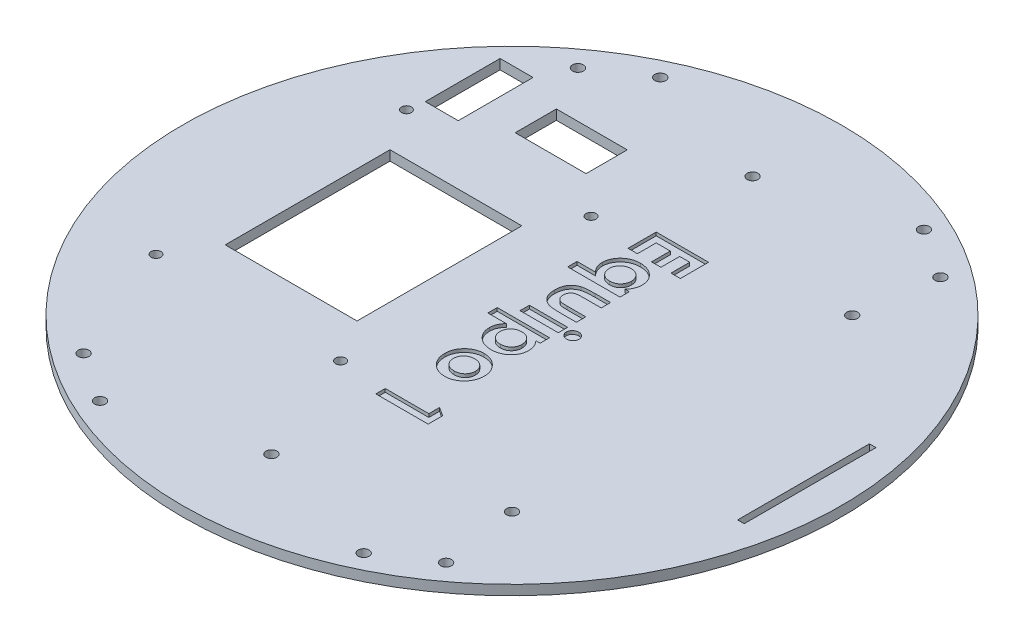
from build123d import *

# Parameters (mm, degrees)
CROQUIS1_R              = 100
CROQUIS1_R_2            = 1.65
CROQUIS1_R_3            = 1.5
CROQUIS1_W              = 10
CROQUIS1_H              = 22.7
CROQUIS1_W_2            = 21.5
CROQUIS1_H_2            = 12.5
CROQUIS1_W_3            = 40
CROQUIS1_H_3            = 50
CROQUIS1_W_4            = 2
CROQUIS1_H_4            = 40
SALIENTE_EXTRUIR1_DEPTH = 3
CROQUIS2_W              = 11.600961538
CROQUIS2_H              = 2.849358975
CORTAR_EXTRUIR1_DEPTH   = 1


with BuildPart() as part:
    # Croquis1 → Saliente-Extruir1 (new body)
    with BuildSketch(Plane(origin=(0, 0, 0), x_dir=(1, 0, 0), z_dir=(0, 1, 0))):
        with Locations(Location((0, 0, 0), (0, 0, 270))):
            Circle(CROQUIS1_R)
        with Locations(Location((55, 75, 0), (0, 0, 270))):
            Circle(CROQUIS1_R_2, mode=Mode.SUBTRACT)
        with Locations(Location((55, -75, 0), (0, 0, 90))):
            Circle(CROQUIS1_R_2, mode=Mode.SUBTRACT)
        with Locations(Location((0, -73, 0), (0, 0, 270))):
            Circle(CROQUIS1_R_2, mode=Mode.SUBTRACT)
        with Locations(Location((51.618795027, -51.618795027, 0), (0, 0, 270))):
            Circle(CROQUIS1_R_2, mode=Mode.SUBTRACT)
        with Locations(Location((51.618795027, 51.618795027, 0), (0, 0, 270))):
            Circle(CROQUIS1_R_2, mode=Mode.SUBTRACT)
        with Locations(Location((0, 73, 0), (0, 0, 270))):
            Circle(CROQUIS1_R_2, mode=Mode.SUBTRACT)
        with Locations(Location((40, -85, 0), (0, 0, 270))):
            Circle(CROQUIS1_R_2, mode=Mode.SUBTRACT)
        with Locations(Location((40, 85, 0), (0, 0, 90))):
            Circle(CROQUIS1_R_2, mode=Mode.SUBTRACT)
        with Locations(Location((-70.020295338, 38, 0), (0, 0, 270))):
            Circle(CROQUIS1_R_3, mode=Mode.SUBTRACT)
        with Locations(Location((-14.020295338, 38, 0), (0, 0, 270))):
            Circle(CROQUIS1_R_3, mode=Mode.SUBTRACT)
        with Locations(Location((-14.020295338, -38, 0), (0, 0, 90))):
            Circle(CROQUIS1_R_3, mode=Mode.SUBTRACT)
        with Locations(Location((-70.020295338, -38, 0), (0, 0, 90))):
            Circle(CROQUIS1_R_3, mode=Mode.SUBTRACT)
        with Locations(Location((-40, -85, 0), (0, 0, 90))):
            Circle(CROQUIS1_R_2, mode=Mode.SUBTRACT)
        with Locations(Location((-55, -75, 0), (0, 0, 270))):
            Circle(CROQUIS1_R_2, mode=Mode.SUBTRACT)
        with Locations(Location((-55, 75, 0), (0, 0, 90))):
            Circle(CROQUIS1_R_2, mode=Mode.SUBTRACT)
        with Locations(Location((-40, 85, 0), (0, 0, 270))):
            Circle(CROQUIS1_R_2, mode=Mode.SUBTRACT)
        with Locations((-64.299296542, 54.335107278)):
            Rectangle(CROQUIS1_W, CROQUIS1_H, mode=Mode.SUBTRACT)
        with Locations((-36.742208882, 54.713188989)):
            Rectangle(CROQUIS1_W_2, CROQUIS1_H_2, mode=Mode.SUBTRACT)
        with Locations((-42.020295338, 0)):
            Rectangle(CROQUIS1_W_3, CROQUIS1_H_3, mode=Mode.SUBTRACT)
        with Locations((89, 0.459343657)):
            Rectangle(CROQUIS1_W_4, CROQUIS1_H_4, mode=Mode.SUBTRACT)
    extrude(amount=SALIENTE_EXTRUIR1_DEPTH)

    # Croquis2 → Cortar-Extruir1 (cut)
    # profile 1 of 8: a face of its own
    with BuildSketch(Plane(origin=(0, 3, 0), x_dir=(1, 0, 0), z_dir=(0, 1, 0))):
        Polygon((15.875, 43.758012821), (15.875, 35.209935897), (13.025641026, 35.209935897), (13.025641026, 40.908653846), (9.97275641, 40.908653846), (9.97275641, 35.209935897), (7.123397436, 35.209935897), (7.123397436, 40.908653846), (2.849358974, 40.908653846), (2.849358974, 35.209935897), (0, 35.209935897), (0, 43.758012821), align=None)
    # profile 2 of 8: a face of its own
    with BuildSketch(Plane(origin=(0, 3, 0), x_dir=(1, 0, 0), z_dir=(0, 1, 0))):
        with BuildLine():
            Line((11.600961538, 24.016025641), (11.600961538, 21.166666667))
            Line((11.600961538, 21.166666667), (-4.274038462, 21.166666667))
            Line((-4.274038462, 21.166666667), (-4.274038462, 24.016025641))
            Line((-4.274038462, 24.016025641), (1.310196314, 24.016025641))
            add(Edge.make_bspline(
                [(1.310196314, 24.016025641), (1.182705355, 24.157092769), (0.935757113, 24.430337862), (0.615378556, 24.861936061), (0.354378825, 25.295294207), (0.142091591, 25.73048468), (-0.014973458, 26.176723268), (-0.121521471, 26.638806522), (-0.19151115, 27.11765791), (-0.199480276, 27.443909989), (-0.203525641, 27.60952524)],
                knots=[0, 0, 0, 0, 1.139408452, 2.207018561, 3.216197651, 4.168344369, 5.104925937, 6.045165285, 7.007667804, 8, 8, 8, 8], degree=3))
            add(Edge.make_bspline(
                [(-0.203525641, 27.60952524), (-0.199344469, 27.795369564), (-0.191082236, 28.16260848), (-0.104117769, 28.70149432), (0.02901976, 29.221828549), (0.217356605, 29.723253731), (0.461659933, 30.204613147), (0.753956, 30.669820187), (1.109289804, 31.108133844), (1.505302715, 31.529047649), (1.943960603, 31.913441124), (2.412740169, 32.254206023), (2.911920377, 32.537382786), (3.435041679, 32.770158264), (3.983367559, 32.952997213), (4.558338939, 33.083403241), (5.160242355, 33.160326524), (5.57023229, 33.169848825), (5.778220152, 33.174679487)],
                knots=[0, 0, 0, 0, 0.980545136, 1.937612761, 2.874348888, 3.813122963, 4.759326438, 5.720509799, 6.70829705, 7.733758992, 8.768951258, 9.783355028, 10.788637727, 11.793421666, 12.80232853, 13.835642703, 14.90202171, 16, 16, 16, 16], degree=3))
            add(Edge.make_bspline(
                [(5.778220152, 33.174679487), (5.993593054, 33.169611753), (6.416070998, 33.159670827), (7.036021596, 33.086905677), (7.625310633, 32.959010712), (8.18447819, 32.784192263), (8.715089265, 32.560628848), (9.213817184, 32.282772034), (9.685139619, 31.957538275), (10.117309543, 31.581719657), (10.511841102, 31.176010106), (10.860146838, 30.744592416), (11.14877756, 30.287352273), (11.390953126, 29.811545214), (11.574543534, 29.3124596), (11.709863619, 28.793096557), (11.790858096, 28.25128417), (11.799906423, 27.882225345), (11.804487179, 27.69538762)],
                knots=[0, 0, 0, 0, 1.136421085, 2.229216585, 3.287981067, 4.314102594, 5.316702899, 6.320753391, 7.321604446, 8.333029371, 9.337827526, 10.304906535, 11.253050047, 12.186157492, 13.117149921, 14.053303955, 15.014476191, 16, 16, 16, 16], degree=3))
            add(Edge.make_bspline(
                [(11.804487179, 27.69538762), (11.800891521, 27.522313136), (11.793777009, 27.179861115), (11.716527019, 26.676505986), (11.599691896, 26.18832411), (11.433222876, 25.717978542), (11.223021872, 25.261611354), (10.959624346, 24.827072347), (10.654100778, 24.40485559), (10.4154804, 24.147236982), (10.293945313, 24.016025641)],
                knots=[0, 0, 0, 0, 1.017011718, 2.012299608, 2.98747302, 3.965332399, 4.941441765, 5.936729654, 6.94912688, 8, 8, 8, 8], degree=3))
            Line((10.293945313, 24.016025641), (11.600961538, 24.016025641))
        make_face()
        with BuildLine():
            add(Edge.make_bspline(
                [(9.158653846, 27.09753105), (9.155170091, 27.211069605), (9.148342159, 27.433597761), (9.107271672, 27.760855868), (9.034903644, 28.073616444), (8.927995423, 28.369648907), (8.797765633, 28.653365226), (8.634654964, 28.920457128), (8.44186162, 29.173128999), (8.224053125, 29.409894852), (7.984641765, 29.625741812), (7.7233921, 29.811814489), (7.447343323, 29.969946203), (7.155665451, 30.103684536), (6.844907033, 30.199410839), (6.519113591, 30.275226032), (6.175623559, 30.314569209), (5.941545733, 30.321700886), (5.822741386, 30.325320513)],
                knots=[0, 0, 0, 0, 1.04836806, 2.054732945, 3.03993516, 4.00574415, 4.955904794, 5.917688631, 6.888591924, 7.88601754, 8.884115178, 9.859153345, 10.841239365, 11.818093293, 12.814750328, 13.83810466, 14.90274714, 16, 16, 16, 16], degree=3))
            add(Edge.make_bspline(
                [(5.822741386, 30.325320513), (5.702858497, 30.321757782), (5.466630654, 30.314737461), (5.120256254, 30.274571775), (4.789656447, 30.201567368), (4.477782074, 30.094637482), (4.178924754, 29.96529649), (3.89874528, 29.80239368), (3.636314535, 29.608468623), (3.389290271, 29.392304657), (3.170241279, 29.150708555), (2.970940116, 28.899037757), (2.811425852, 28.627418798), (2.67510816, 28.345228985), (2.570409389, 28.049899345), (2.496955214, 27.739632089), (2.452004353, 27.41685702), (2.445562232, 27.19625709), (2.442307692, 27.084810697)],
                knots=[0, 0, 0, 0, 1.099386164, 2.166327687, 3.192099357, 4.19717067, 5.185034887, 6.173616074, 7.161193358, 8.17338296, 9.177655011, 10.147763629, 11.111227589, 12.058972978, 13.018112925, 13.97759754, 14.978288615, 16, 16, 16, 16], degree=3))
            add(Edge.make_bspline(
                [(2.442307692, 27.084810697), (2.445811079, 26.969157453), (2.452679622, 26.742414224), (2.493373865, 26.409815653), (2.56601244, 26.092858719), (2.673513826, 25.792831788), (2.802878561, 25.505263884), (2.962541517, 25.232337048), (3.156358201, 24.977948758), (3.372463452, 24.736092064), (3.618697596, 24.52247288), (3.878710723, 24.328470569), (4.161618889, 24.169460791), (4.461219477, 24.039009801), (4.77862315, 23.93677771), (5.113871089, 23.863036473), (5.467723387, 23.823015946), (5.709225797, 23.816049635), (5.832281651, 23.8125)],
                knots=[0, 0, 0, 0, 1.049905731, 2.058385982, 3.036337956, 3.994927362, 4.946537361, 5.895419282, 6.857623746, 7.845325573, 8.833777008, 9.811444928, 10.78531754, 11.772081556, 12.77319045, 13.807459548, 14.882806445, 16, 16, 16, 16], degree=3))
            add(Edge.make_bspline(
                [(5.832281651, 23.8125), (5.953220966, 23.816005526), (6.18945058, 23.822852836), (6.535915008, 23.863209778), (6.864578235, 23.937472302), (7.17644787, 24.037595466), (7.468869386, 24.17030519), (7.745012077, 24.3295017), (8.001354596, 24.521398943), (8.241310317, 24.737363961), (8.454387149, 24.977834782), (8.645675208, 25.233743387), (8.80307129, 25.508010228), (8.936384619, 25.79545713), (9.032883331, 26.100698398), (9.107866972, 26.418156725), (9.148313434, 26.753053276), (9.155150794, 26.980831296), (9.158653846, 27.09753105)],
                knots=[0, 0, 0, 0, 1.106469885, 2.16125711, 3.184599668, 4.184238692, 5.152050012, 6.116650044, 7.094080022, 8.075733422, 9.064591803, 10.028460505, 10.993060537, 11.952039452, 12.921015874, 13.915988178, 14.932277727, 16, 16, 16, 16], degree=3))
        make_face(mode=Mode.SUBTRACT)
    # profile 3 of 8: a face of its own
    with BuildSketch(Plane(origin=(0, 3, 0), x_dir=(1, 0, 0), z_dir=(0, 1, 0))):
        with BuildLine():
            Line((11.600961538, 18.317307692), (11.600961538, 15.467948718))
            Line((11.600961538, 15.467948718), (6.032627204, 15.467948718))
            add(Edge.make_bspline(
                [(6.032627204, 15.467948718), (5.902230254, 15.467695694), (5.651966663, 15.467210078), (5.292539159, 15.453696968), (4.963859142, 15.434735422), (4.665539135, 15.411072635), (4.398296391, 15.375754615), (4.162642046, 15.334980852), (3.9568752, 15.288758392), (3.727529325, 15.213587273), (3.476502411, 15.096024264), (3.210228984, 14.918292937), (2.978576056, 14.703106139), (2.784234855, 14.450658865), (2.62913484, 14.164384176), (2.523090713, 13.845637122), (2.453265839, 13.497186133), (2.446056675, 13.253913145), (2.442307692, 13.127403846)],
                knots=[0, 0, 0, 0, 1.267467482, 2.432579623, 3.495718977, 4.46782216, 5.340771086, 6.114964255, 6.792308577, 7.388622481, 8.458084915, 9.475498183, 10.488937983, 11.51740562, 12.559360757, 13.637967653, 14.771671862, 16, 16, 16, 16], degree=3))
            add(Edge.make_bspline(
                [(2.442307692, 13.127403846), (2.446546729, 13.000997011), (2.45472659, 12.757075965), (2.518515318, 12.405444818), (2.62781943, 12.084571363), (2.776077557, 11.791160022), (2.974495808, 11.533863516), (3.21092523, 11.30984597), (3.489179721, 11.121228453), (3.696749598, 11.030589038), (3.803385417, 10.984024439)],
                knots=[0, 0, 0, 0, 1.116871431, 2.155171802, 3.144773418, 4.104381479, 5.046960687, 6.001340237, 6.973219418, 8, 8, 8, 8], degree=3))
            add(Edge.make_bspline(
                [(3.803385417, 10.984024439), (3.850752537, 10.966922485), (3.955309995, 10.929171895), (4.135721565, 10.895893992), (4.348192563, 10.858348722), (4.598252471, 10.836443202), (4.882179806, 10.813019652), (5.202496427, 10.797982309), (5.55767251, 10.788443406), (5.806833088, 10.787403291), (5.937224559, 10.786858974)],
                knots=[0, 0, 0, 0, 0.56097549, 1.238288705, 2.041265676, 2.968564175, 4.036154886, 5.220272437, 6.545304513, 8, 8, 8, 8], degree=3))
            Line((5.937224559, 10.786858974), (11.600961538, 10.786858974))
            Line((11.600961538, 10.786858974), (11.600961538, 7.9375))
            Line((11.600961538, 7.9375), (6.725886418, 7.9375))
            add(Edge.make_bspline(
                [(6.725886418, 7.9375), (6.484164326, 7.93794166), (6.020709914, 7.938788457), (5.355987143, 7.966574364), (4.75121546, 8.001763606), (4.206295595, 8.057111578), (3.71820111, 8.11986949), (3.29090059, 8.206561145), (2.920004648, 8.300525419), (2.700276104, 8.387023602), (2.598132011, 8.427233574)],
                knots=[0, 0, 0, 0, 1.388116509, 2.661439483, 3.820463473, 4.866642689, 5.806839029, 6.644994921, 7.370105668, 8, 8, 8, 8], degree=3))
            add(Edge.make_bspline(
                [(2.598132011, 8.427233574), (2.488186281, 8.478745772), (2.271162854, 8.580426427), (1.962684993, 8.756951183), (1.6701109, 8.946908519), (1.402374948, 9.160494194), (1.150066606, 9.388408436), (0.919150603, 9.635157407), (0.70921315, 9.901043325), (0.515122993, 10.181546008), (0.349485797, 10.484996834), (0.196361436, 10.803633063), (0.074471144, 11.145439876), (-0.027695055, 11.50556631), (-0.106871892, 11.886033682), (-0.164220551, 12.285307065), (-0.194929733, 12.705033257), (-0.20061339, 12.990614875), (-0.203525641, 13.136944111)],
                knots=[0, 0, 0, 0, 0.997222436, 1.96843142, 2.917797601, 3.860467999, 4.779133207, 5.709613475, 6.633219993, 7.560883278, 8.508369802, 9.470751391, 10.462672762, 11.485580885, 12.544670258, 13.653244457, 14.797545346, 16, 16, 16, 16], degree=3))
            add(Edge.make_bspline(
                [(-0.203525641, 13.136944111), (-0.201641841, 13.29501605), (-0.197955882, 13.604309234), (-0.152817334, 14.056182255), (-0.094413921, 14.486823318), (0.004882587, 14.891424344), (0.119922557, 15.275635774), (0.26674416, 15.635046644), (0.439364764, 15.971125596), (0.636760979, 16.284533912), (0.860741733, 16.572840909), (1.101625235, 16.842457418), (1.368995478, 17.084679058), (1.654595963, 17.30741338), (1.96105521, 17.508174545), (2.287283545, 17.687062196), (2.634764818, 17.844227862), (2.878299574, 17.928083541), (3.002003205, 17.970678085)],
                knots=[0, 0, 0, 0, 1.211240017, 2.369985978, 3.478996442, 4.539426614, 5.559871561, 6.551301256, 7.510778031, 8.453136967, 9.386094087, 10.30661716, 11.221130616, 12.147659962, 13.080758632, 14.026335491, 14.997475882, 16, 16, 16, 16], degree=3))
            add(Edge.make_bspline(
                [(3.002003205, 17.970678085), (3.09807618, 17.999737472), (3.305039765, 18.062338166), (3.648989087, 18.129927735), (4.045409938, 18.18398833), (4.494692255, 18.236576768), (4.99758926, 18.273263424), (5.553302285, 18.297242257), (6.162918027, 18.313444014), (6.587011348, 18.315981857), (6.80856871, 18.317307692)],
                knots=[0, 0, 0, 0, 0.627914866, 1.352675004, 2.190563461, 3.132055958, 4.183353232, 5.345633452, 6.613289997, 8, 8, 8, 8], degree=3))
            Line((6.80856871, 18.317307692), (11.600961538, 18.317307692))
        make_face()
    # profile 4 of 8: a face of its own
    with BuildSketch(Plane(origin=(0, 3, 0), x_dir=(1, 0, 0), z_dir=(0, 1, 0))):
        with BuildLine():
            add(Edge.make_bspline(
                [(16.485576923, 3.873347356), (16.479552428, 3.750538073), (16.467722753, 3.509390215), (16.352379597, 3.163946293), (16.171422459, 2.846765456), (15.92287827, 2.566888984), (15.627438307, 2.33246328), (15.292946062, 2.160163731), (14.927252059, 2.054825101), (14.67256665, 2.041870218), (14.542543069, 2.03525641)],
                knots=[0, 0, 0, 0, 0.990072662, 1.944103057, 2.911436544, 3.925658634, 4.950936715, 5.943676444, 6.950192893, 8, 8, 8, 8], degree=3))
            add(Edge.make_bspline(
                [(14.542543069, 2.03525641), (14.413632129, 2.042066341), (14.162443023, 2.055335816), (13.799333367, 2.157378418), (13.468904061, 2.329045718), (13.173268084, 2.560171451), (12.932265348, 2.840830028), (12.746647644, 3.150803338), (12.637968177, 3.493186577), (12.625115717, 3.730558581), (12.618589744, 3.851086739)],
                knots=[0, 0, 0, 0, 1.052811311, 2.051452972, 3.055194368, 4.079667233, 5.099438635, 6.06248364, 7.016205477, 8, 8, 8, 8], degree=3))
            add(Edge.make_bspline(
                [(12.618589744, 3.851086739), (12.62459448, 3.974964167), (12.636385017, 4.218202389), (12.7519724, 4.566535401), (12.9316034, 4.887729778), (13.184830409, 5.167238123), (13.484620915, 5.401735253), (13.821952255, 5.577914952), (14.194513536, 5.678320387), (14.451849984, 5.691801207), (14.583884215, 5.698717949)],
                knots=[0, 0, 0, 0, 0.988868435, 1.941682217, 2.906962409, 3.916910146, 4.938874109, 5.940910673, 6.943522087, 8, 8, 8, 8], degree=3))
            add(Edge.make_bspline(
                [(14.583884215, 5.698717949), (14.710637554, 5.691681985), (14.959626189, 5.677860849), (15.319102371, 5.577782626), (15.646986564, 5.404421838), (15.934660012, 5.169112791), (16.181706517, 4.89465114), (16.355904391, 4.577604723), (16.466711223, 4.234683839), (16.479223424, 3.995036507), (16.485576923, 3.873347356)],
                knots=[0, 0, 0, 0, 1.038763745, 2.040501419, 3.031928819, 4.058179968, 5.07455544, 6.03952971, 7.004503979, 8, 8, 8, 8], degree=3))
        make_face()
    # profile 5 of 8: a face of its own
    with BuildSketch(Plane(origin=(0, 3, 0), x_dir=(1, 0, 0), z_dir=(0, 1, 0))):
        with Locations((5.800480769, 3.86698718)):
            Rectangle(CROQUIS2_W, CROQUIS2_H)
    # profile 6 of 8: a face of its own
    with BuildSketch(Plane(origin=(0, 3, 0), x_dir=(1, 0, 0), z_dir=(0, 1, 0))):
        with BuildLine():
            Line((11.600961538, -3.052884615), (10.293945313, -3.052884615))
            add(Edge.make_bspline(
                [(10.293945313, -3.052884615), (10.415487473, -3.185166935), (10.654183735, -3.444955761), (10.959740403, -3.87031602), (11.222342865, -4.307377702), (11.432503856, -4.763540871), (11.600904646, -5.233306811), (11.715600021, -5.720986184), (11.794098352, -6.224076005), (11.800992287, -6.565514135), (11.804487179, -6.738606771)],
                knots=[0, 0, 0, 0, 1.054345398, 2.070625563, 3.070134531, 4.045138923, 5.016019057, 5.996139535, 6.984139557, 8, 8, 8, 8], degree=3))
            add(Edge.make_bspline(
                [(11.804487179, -6.738606771), (11.800011463, -6.925464626), (11.791195754, -7.293513968), (11.708888436, -7.835028534), (11.575844343, -8.353972516), (11.390078449, -8.852324553), (11.148892751, -9.32743034), (10.860117334, -9.784624761), (10.511840823, -10.216035475), (10.117343254, -10.621823462), (9.685005046, -10.997332369), (9.21473756, -11.323424328), (8.714133421, -11.596810101), (8.18461107, -11.821292147), (7.625273459, -11.995802291), (7.036031987, -12.12378349), (6.416068243, -12.196524807), (5.993592124, -12.206469041), (5.778220152, -12.211538462)],
                knots=[0, 0, 0, 0, 0.986020426, 1.942140297, 2.884184618, 3.810402461, 4.74398011, 5.692601402, 6.660167734, 7.665472218, 8.677406811, 9.678762208, 10.680617953, 11.68372348, 12.710362081, 13.769660087, 14.863006259, 16, 16, 16, 16], degree=3))
            add(Edge.make_bspline(
                [(5.778220152, -12.211538462), (5.570229461, -12.206714263), (5.160233948, -12.197204705), (4.558371021, -12.120188919), (3.983252451, -11.990119162), (3.435866735, -11.806198554), (2.911145705, -11.57815442), (2.412726298, -11.294134208), (1.944994707, -10.953371447), (1.504442115, -10.572260515), (1.108147286, -10.151128328), (0.756017565, -9.710521804), (0.460555089, -9.247488151), (0.217612644, -8.766335639), (0.028325999, -8.26418492), (-0.103230755, -7.743456083), (-0.191398892, -7.204832383), (-0.199443131, -6.838606626), (-0.203525641, -6.652744391)],
                knots=[0, 0, 0, 0, 1.098417511, 2.1652231, 3.198950626, 4.208261081, 5.211182938, 6.216867778, 7.231677337, 8.263598561, 9.289470716, 10.282037912, 11.238882362, 12.185464344, 13.124613954, 14.067146156, 15.019062619, 16, 16, 16, 16], degree=3))
            add(Edge.make_bspline(
                [(-0.203525641, -6.652744391), (-0.199508962, -6.487121695), (-0.191596347, -6.160854949), (-0.121045338, -5.681087293), (-0.015666111, -5.217626289), (0.142941374, -4.769858872), (0.353412172, -4.332751337), (0.615515497, -3.898859196), (0.935719324, -3.467179131), (1.182692488, -3.193945714), (1.310196314, -3.052884615)],
                knots=[0, 0, 0, 0, 0.990856396, 1.951927477, 2.896945079, 3.83213376, 4.788585491, 5.796263726, 6.862286081, 8, 8, 8, 8], degree=3))
            Line((1.310196314, -3.052884615), (-4.274038462, -3.052884615))
            Line((-4.274038462, -3.052884615), (-4.274038462, -0.203525641))
            Line((-4.274038462, -0.203525641), (11.600961538, -0.203525641))
            Line((11.600961538, -0.203525641), (11.600961538, -3.052884615))
        make_face()
        with BuildLine():
            add(Edge.make_bspline(
                [(9.158653846, -6.121669671), (9.155098078, -6.006034084), (9.14812684, -5.77932547), (9.108172098, -5.446477633), (9.033004956, -5.131091995), (8.935554764, -4.828403601), (8.804108651, -4.542134859), (8.644419788, -4.270356043), (8.455784846, -4.014481255), (8.238859456, -3.77779359), (8.003829778, -3.557333182), (7.742787362, -3.370720947), (7.470052884, -3.206288599), (7.176255453, -3.074758893), (6.864631798, -2.974246526), (6.535900111, -2.900092323), (6.189454567, -2.859705501), (5.953222316, -2.852862364), (5.832281651, -2.849358974)],
                knots=[0, 0, 0, 0, 1.060568847, 2.079291485, 3.067175794, 4.029236509, 4.990511307, 5.949030319, 6.915206611, 7.899210179, 8.889768581, 9.863784456, 10.835615511, 11.805743859, 12.80777611, 13.833568643, 14.890881125, 16, 16, 16, 16], degree=3))
            add(Edge.make_bspline(
                [(5.832281651, -2.849358974), (5.709224455, -2.852906441), (5.46771941, -2.859868496), (5.113886066, -2.899919636), (4.778570036, -2.973550902), (4.461409807, -3.076176174), (4.160437018, -3.205404323), (3.880917287, -3.369721817), (3.616241747, -3.558367732), (3.37487545, -3.776547601), (3.155097959, -4.01465537), (2.962747023, -4.269398995), (2.802823662, -4.542068636), (2.673528663, -4.829705416), (2.566008369, -5.129713672), (2.493374996, -5.446675745), (2.452679322, -5.779272902), (2.445810978, -6.006016327), (2.442307692, -6.121669671)],
                knots=[0, 0, 0, 0, 1.117303121, 2.19275548, 3.227126012, 4.228333087, 5.215193878, 6.193951608, 7.166063962, 8.161008357, 9.141703709, 10.104002538, 11.052977519, 12.004680845, 12.963364262, 13.941412147, 14.949991302, 16, 16, 16, 16], degree=3))
            add(Edge.make_bspline(
                [(2.442307692, -6.121669671), (2.445521515, -6.233128067), (2.451883042, -6.453751754), (2.497565115, -6.777376722), (2.569023625, -7.0882806), (2.676920486, -7.383417693), (2.809322928, -7.666488125), (2.973145504, -7.936539067), (3.168941728, -8.190640659), (3.389455771, -8.432263725), (3.636402721, -8.648299899), (3.897821982, -8.843000242), (4.179899608, -9.001509079), (4.477648117, -9.131730568), (4.789693369, -9.238361816), (5.120245888, -9.311448865), (5.466633381, -9.351591669), (5.702859415, -9.358615151), (5.822741386, -9.362179487)],
                knots=[0, 0, 0, 0, 1.021479428, 2.021943319, 2.990662685, 3.940432525, 4.896741647, 5.851667391, 6.829265152, 7.833309205, 8.845269013, 9.832622089, 10.816142259, 11.803782204, 12.808625337, 13.834164129, 14.900863427, 16, 16, 16, 16], degree=3))
            add(Edge.make_bspline(
                [(5.822741386, -9.362179487), (5.941545733, -9.358559861), (6.17562356, -9.351428183), (6.519113588, -9.312085005), (6.844907042, -9.236269818), (7.155665417, -9.140543494), (7.447343447, -9.006805238), (7.723391637, -8.848673236), (7.984643495, -8.662601637), (8.224046499, -8.446750566), (8.441886034, -8.209999985), (8.634566899, -7.957272772), (8.798593214, -7.68956141), (8.927946542, -7.403220256), (9.034376454, -7.10500651), (9.107686785, -6.790362844), (9.148260823, -6.460888876), (9.155142976, -6.23626141), (9.158653846, -6.121669671)],
                knots=[0, 0, 0, 0, 1.094680664, 2.156827393, 3.177782763, 4.17210342, 5.146667393, 6.126451192, 7.099203661, 8.094961544, 9.09004898, 10.058676268, 11.018205477, 11.974998356, 12.947750825, 13.930643515, 14.944335875, 16, 16, 16, 16], degree=3))
        make_face(mode=Mode.SUBTRACT)
    # profile 7 of 8: a face of its own
    with BuildSketch(Plane(origin=(0, 3, 0), x_dir=(1, 0, 0), z_dir=(0, 1, 0))):
        with BuildLine():
            add(Edge.make_bspline(
                [(11.804487179, -20.180839343), (11.802092035, -20.315552183), (11.797348563, -20.582344647), (11.757796561, -20.979687296), (11.693436116, -21.370128643), (11.60928908, -21.756690248), (11.4935358, -22.135544818), (11.352490642, -22.507493348), (11.191499315, -22.875640482), (10.999783127, -23.231681869), (10.791617385, -23.577965841), (10.563454273, -23.906371796), (10.312197569, -24.211229849), (10.050749272, -24.504144448), (9.761116986, -24.767640708), (9.463753685, -25.023693405), (9.140670584, -25.250074035), (8.804813041, -25.460475868), (8.456161622, -25.647079623), (8.098602696, -25.810643694), (7.733732385, -25.946643477), (7.361752756, -26.058154482), (6.98430543, -26.149179463), (6.597896518, -26.206928436), (6.206288562, -26.247894574), (5.94263332, -26.252494193), (5.810021034, -26.254807692)],
                knots=[0, 0, 0, 0, 1.022204334, 2.024427765, 3.026941746, 4.024310199, 5.024497409, 6.030105378, 7.042160749, 8.071431822, 9.096544462, 10.107544126, 11.102638816, 12.093496961, 13.083897781, 14.071714019, 15.069569032, 16.074114518, 17.078305592, 18.068346939, 19.056064894, 20.030822231, 21.014304768, 21.999661014, 22.993877291, 24, 24, 24, 24], degree=3))
            add(Edge.make_bspline(
                [(5.810021034, -26.254807692), (5.676372082, -26.252367922), (5.41064767, -26.247517106), (5.015365473, -26.208392007), (4.627104639, -26.143665827), (4.243577858, -26.059855856), (3.869692719, -25.943312307), (3.499938011, -25.807143611), (3.139353627, -25.63999118), (2.784005932, -25.45519185), (2.444351723, -25.243772386), (2.119348514, -25.017077325), (1.817522666, -24.765835906), (1.52951372, -24.503876072), (1.265060849, -24.218772475), (1.019870043, -23.915075901), (0.790943737, -23.595415518), (0.583652972, -23.257492632), (0.401513968, -22.905635469), (0.237300793, -22.545778036), (0.100581599, -22.175816087), (-0.010909138, -21.796515276), (-0.097233626, -21.407645572), (-0.155874877, -21.010065497), (-0.196659191, -20.604631293), (-0.201222089, -20.331465691), (-0.203525641, -20.193559696)],
                knots=[0, 0, 0, 0, 1.012026251, 2.012137606, 3.004615893, 3.992048833, 4.982446996, 5.968083444, 6.973977695, 7.990229942, 8.999482246, 10.001782172, 10.988562221, 11.971415814, 12.948383116, 13.930088534, 14.925840678, 15.924049238, 16.929462851, 17.924729459, 18.917889337, 19.913673841, 20.916777188, 21.931792057, 22.95587778, 24, 24, 24, 24], degree=3))
            add(Edge.make_bspline(
                [(-0.203525641, -20.193559696), (-0.197608167, -19.991912189), (-0.185944734, -19.594461882), (-0.106018349, -19.009125722), (0.031458412, -18.446756006), (0.223435894, -17.906695923), (0.467830259, -17.388096635), (0.775231381, -16.8974625), (1.127237912, -16.423277162), (1.536579668, -15.983453373), (1.98155369, -15.578186445), (2.455013304, -15.220204407), (2.954440549, -14.919904034), (3.476052909, -14.672607417), (4.022082039, -14.48197565), (4.59063753, -14.344247714), (5.183387221, -14.264246028), (5.586115867, -14.252678186), (5.790940505, -14.246794872)],
                knots=[0, 0, 0, 0, 1.030065369, 2.030274526, 3.011405238, 3.982561859, 4.953899644, 5.933774183, 6.935609257, 7.966528366, 8.997788773, 10.007205882, 10.993508831, 11.969740339, 12.951110141, 13.942765373, 14.95370657, 16, 16, 16, 16], degree=3))
            add(Edge.make_bspline(
                [(5.790940505, -14.246794872), (6.009648555, -14.252883036), (6.439514849, -14.264849201), (7.069278765, -14.359865815), (7.672247869, -14.511597098), (8.246735465, -14.729397797), (8.793801118, -15.007619034), (9.312291006, -15.347264111), (9.802322573, -15.750011575), (10.098710463, -16.058435485), (10.249424079, -16.215269431)],
                knots=[0, 0, 0, 0, 1.043912699, 2.05178951, 3.033892, 4.007821512, 4.978932272, 5.95884105, 6.962068106, 8, 8, 8, 8], degree=3))
            add(Edge.make_bspline(
                [(10.249424079, -16.215269431), (10.374348713, -16.359180254), (10.620799156, -16.643086515), (10.93338114, -17.10434075), (11.20335661, -17.576613038), (11.425326659, -18.065563765), (11.592688495, -18.572556001), (11.714512938, -19.094991697), (11.78934108, -19.632762221), (11.799412823, -19.997218548), (11.804487179, -20.180839343)],
                knots=[0, 0, 0, 0, 1.048115528, 2.067714963, 3.060638214, 4.039924844, 5.017819947, 5.994373833, 6.98952318, 8, 8, 8, 8], degree=3))
        make_face()
        with BuildLine():
            add(Edge.make_bspline(
                [(9.158653846, -20.244441106), (9.15498391, -20.134123337), (9.1477596, -19.916961621), (9.109070285, -19.597266546), (9.029506298, -19.294999756), (8.929472367, -19.004570382), (8.792720383, -18.731911193), (8.635763011, -18.466820355), (8.437810953, -18.224131956), (8.22119941, -17.991877349), (7.978935033, -17.782430233), (7.71982358, -17.597859824), (7.441869258, -17.443767751), (7.149287947, -17.316273754), (6.839168044, -17.217229058), (6.511964816, -17.148715464), (6.169684645, -17.101479531), (5.935269173, -17.09794596), (5.81638121, -17.096153846)],
                knots=[0, 0, 0, 0, 1.03091935, 2.029375836, 2.999546758, 3.945310493, 4.892938212, 5.843870658, 6.816514129, 7.811084694, 8.807723078, 9.802195069, 10.777355085, 11.770643415, 12.778919339, 13.812070992, 14.890353012, 16, 16, 16, 16], degree=3))
            add(Edge.make_bspline(
                [(5.81638121, -17.096153846), (5.693296277, -17.098240356), (5.452750413, -17.102318038), (5.101522473, -17.144546489), (4.768204334, -17.214175765), (4.453334783, -17.313120575), (4.154567651, -17.43747874), (3.873893021, -17.590349095), (3.611267216, -17.772402272), (3.372035288, -17.982942288), (3.15144309, -18.209014685), (2.964722294, -18.457150408), (2.7992556, -18.714305304), (2.669082721, -18.99072682), (2.56754436, -19.280733535), (2.492978542, -19.585095789), (2.452763423, -19.905215916), (2.44584086, -20.123494747), (2.442307692, -20.234900841)],
                knots=[0, 0, 0, 0, 1.141867413, 2.231560573, 3.277337037, 4.297914881, 5.290025546, 6.276167544, 7.258622282, 8.248877712, 9.22995232, 10.184273261, 11.125934698, 12.063217848, 13.012199532, 13.973794674, 14.965856561, 16, 16, 16, 16], degree=3))
            add(Edge.make_bspline(
                [(2.442307692, -20.234900841), (2.445443333, -20.346361411), (2.451591008, -20.564888831), (2.497599322, -20.885402459), (2.570079427, -21.191254743), (2.672115052, -21.483973075), (2.80726745, -21.761330244), (2.969508242, -22.025986877), (3.161370827, -22.276484081), (3.384712666, -22.505902652), (3.625810876, -22.719020819), (3.89061107, -22.901335985), (4.170267501, -23.057745906), (4.467707986, -23.185214276), (4.780893359, -23.284408127), (5.11128646, -23.352869309), (5.457781227, -23.400263098), (5.695371643, -23.40369883), (5.81638121, -23.405448718)],
                knots=[0, 0, 0, 0, 1.031329209, 2.022003956, 2.990520627, 3.936919834, 4.884741893, 5.840502849, 6.805983488, 7.79826013, 8.799661902, 9.779443072, 10.767637054, 11.760883284, 12.769325295, 13.802659215, 14.880850239, 16, 16, 16, 16], degree=3))
            add(Edge.make_bspline(
                [(5.81638121, -23.405448718), (5.937348135, -23.403335485), (6.174724484, -23.399188635), (6.521692802, -23.356959694), (6.851000384, -23.288004756), (7.16126248, -23.18781628), (7.455941412, -23.064080771), (7.733811451, -22.911536064), (7.991888623, -22.727773421), (8.233488906, -22.523318827), (8.449669053, -22.292960965), (8.640450742, -22.04654923), (8.800959808, -21.782859249), (8.932179278, -21.504636889), (9.033322052, -21.21123149), (9.108349713, -20.902755231), (9.147982114, -20.578322088), (9.155059425, -20.356897919), (9.158653846, -20.244441106)],
                knots=[0, 0, 0, 0, 1.123798992, 2.205258179, 3.242884828, 4.246127484, 5.230570643, 6.209477068, 7.185255276, 8.170486857, 9.146165591, 10.115657081, 11.061842515, 12.009360533, 12.968990825, 13.941530959, 14.954545611, 16, 16, 16, 16], degree=3))
        make_face(mode=Mode.SUBTRACT)
    # profile 8 of 8: a face of its own
    with BuildSketch(Plane(origin=(0, 3, 0), x_dir=(1, 0, 0), z_dir=(0, 1, 0))):
        Polygon((15.875, -36.911283053), (15.875, -41.315705128), (0, -41.315705128), (0, -38.466346154), (13.229166667, -38.466346154), (13.229166667, -35.209935897), align=None)
    extrude(amount=-CORTAR_EXTRUIR1_DEPTH, mode=Mode.SUBTRACT)


solid = part.part
